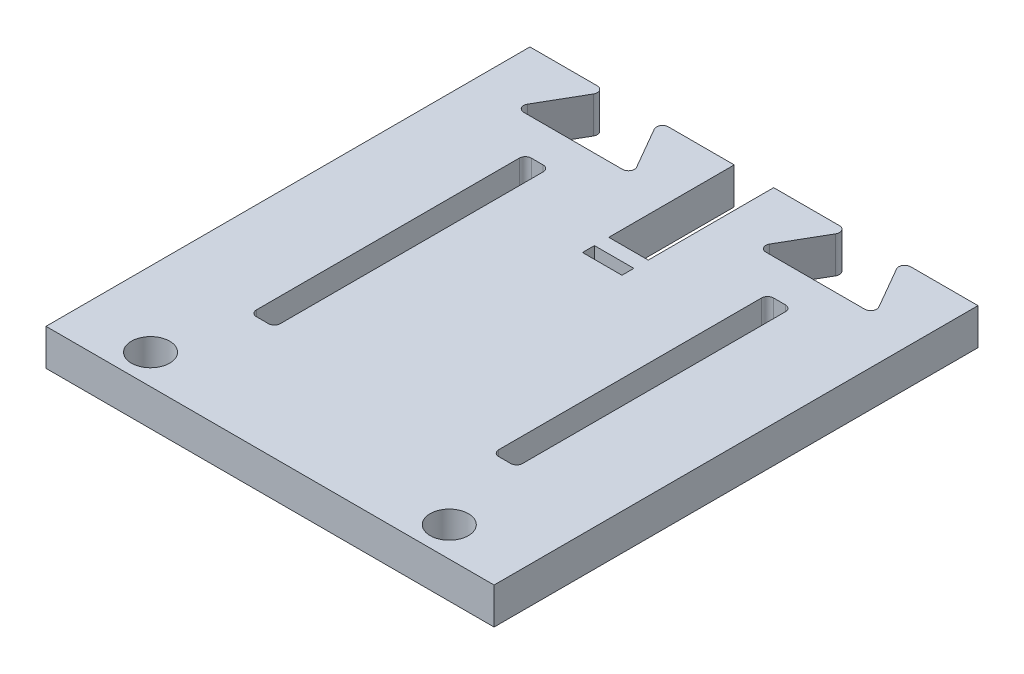
from build123d import *

# Parameters (mm, degrees)
BOSS_EXTRUDE1_DEPTH                = 3.05
FILLET3_R                          = 0.5
SKETCH2_W                          = 3.3
SKETCH2_H                          = 46
SKETCH2_H_2                        = 1
CUT_EXTRUDE1_DEPTH                 = 45.945689448
SKETCH6_W                          = 2
SKETCH6_H                          = 23
CUT_EXTRUDE2_DEPTH                 = 45.945689448
FILLET4_R                          = 0.5
M3_CLEARANCE_HEAD_MOUNTING_HOLES_D = 3.2
SKETCH7_W                          = 0.5
SKETCH7_H                          = 40.5
CUT_EXTRUDE3_DEPTH                 = 45.945689448


with BuildPart() as part:
    # Sketch1 → Boss-Extrude1 (new body)
    with BuildSketch(Plane(origin=(0, 0, 0), x_dir=(1, 0, 0), z_dir=(0, 1, 0))):
        Polygon((-19.25, 0), (-19.25, 40.5), (-12.25, 40.5), (-15.136751346, 35.5), (-5.136751346, 35.5), (-8.023502692, 40.5), (8.023502692, 40.5), (5.136751346, 35.5), (15.136751346, 35.5), (12.25, 40.5), (19.25, 40.5), (19.25, 0), align=None)
    extrude(amount=BOSS_EXTRUDE1_DEPTH)

    # Fillet3
    fillet3_edges = [part.edges().sort_by_distance(p)[0] for p in [
        (-12.25, 1.525, -40.5),
        (-15.136751346, 1.525, -35.5),
        (-5.136751346, 1.525, -35.5),
        (-8.023502692, 1.525, -40.5),
        (8.023502692, 1.525, -40.5),
        (5.136751346, 1.525, -35.5),
        (15.136751346, 1.525, -35.5),
        (12.25, 1.525, -40.5),
    ]]
    fillet(fillet3_edges, radius=FILLET3_R)

    # Sketch2 → Cut-Extrude1 (cut, through all)
    with BuildSketch(Plane(origin=(0, 3.05, 0), x_dir=(1, 0, 0), z_dir=(0, 1, 0))):
        with Locations((0, 53)):
            Rectangle(SKETCH2_W, SKETCH2_H)
        with Locations((0, 28.3)):
            Rectangle(SKETCH2_W, SKETCH2_H_2)
    extrude(amount=-CUT_EXTRUDE1_DEPTH, mode=Mode.SUBTRACT)

    # Sketch6 → Cut-Extrude2 (cut, through all)
    with BuildSketch(Plane(origin=(0, 3.05, 0), x_dir=(1, 0, 0), z_dir=(0, 1, 0))):
        with Locations((-10.136751346, 21)):
            Rectangle(SKETCH6_W, SKETCH6_H)
        with Locations((10.136751346, 21)):
            Rectangle(SKETCH6_W, SKETCH6_H)
    extrude(amount=-CUT_EXTRUDE2_DEPTH, mode=Mode.SUBTRACT)

    # Fillet4
    fillet4_edges = [part.edges().sort_by_distance(p)[0] for p in [
        (-11.136751346, 1.525, -9.5),
        (-11.136751346, 1.525, -32.5),
        (-9.136751346, 1.525, -32.5),
        (-9.136751346, 1.525, -9.5),
        (11.136751346, 1.525, -32.5),
        (11.136751346, 1.525, -9.5),
        (9.136751346, 1.525, -9.5),
        (9.136751346, 1.525, -32.5),
    ]]
    fillet(fillet4_edges, radius=FILLET4_R)

    # M3 Clearance Head Mounting Holes (through all)
    with Locations(Plane(origin=(0, 3.05, 0), x_dir=(1, 0, 0), z_dir=(0, 1, 0))):
        with Locations((-12.5, 2.5), (12.5, 2.5)):
            Hole(M3_CLEARANCE_HEAD_MOUNTING_HOLES_D / 2)

    # Sketch7 → Cut-Extrude3 (cut, through all)
    with BuildSketch(Plane(origin=(0, 3.05, 0), x_dir=(1, 0, 0), z_dir=(0, 1, 0))):
        with Locations((-19, 20.25)):
            Rectangle(SKETCH7_W, SKETCH7_H)
        with Locations((19, 20.25)):
            Rectangle(SKETCH7_W, SKETCH7_H)
    extrude(amount=-CUT_EXTRUDE3_DEPTH, mode=Mode.SUBTRACT)


solid = part.part
